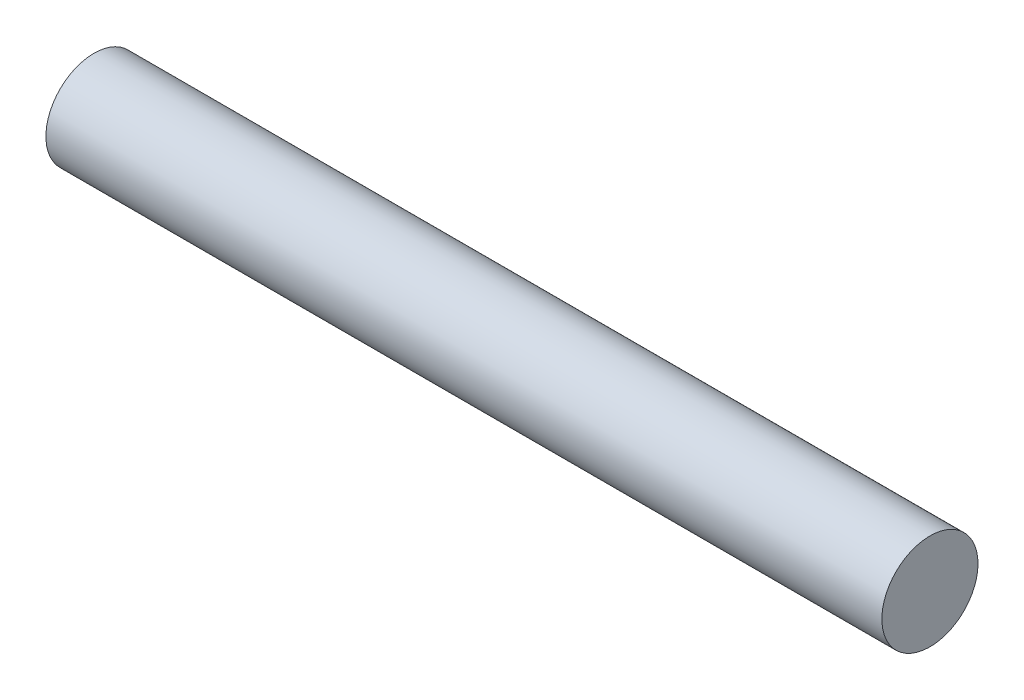
from build123d import *

# Parameters (mm, degrees)
SKETCH1_R           = 1.15
BOSS_EXTRUDE1_DEPTH = 20


with BuildPart() as part:
    # Sketch1 → Boss-Extrude1 (new body)
    with BuildSketch(Plane(origin=(0, 0, 0), x_dir=(0, 0, -1), z_dir=(1, 0, 0))):
        Circle(SKETCH1_R)
    extrude(amount=BOSS_EXTRUDE1_DEPTH)


solid = part.part
